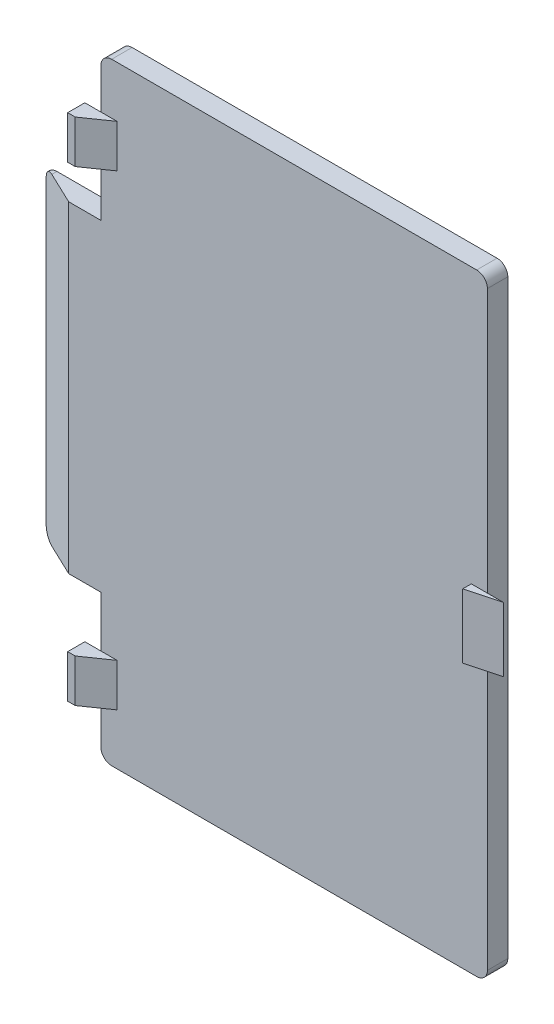
from build123d import *

# Parameters (mm, degrees)
RESSALTO_EXTRUS_O2_DEPTH = 1.9
RESSALTO_EXTRUS_O3_DEPTH = 1.5
CORTE_EXTRUS_O1_DEPTH    = 100
ESBO_O5_W                = 0.8
ESBO_O5_H                = 6
RESSALTO_EXTRUS_O4_DEPTH = 1.5
CORTE_EXTRUS_O2_DEPTH    = 100
CORTE_EXTRUS_O3_DEPTH    = 1000


with BuildPart() as part:
    # Esboço1 → Ressalto-extrusão2 (new body)
    with BuildSketch(Plane.XY):
        with BuildLine():
            Line((-23.801253488, -0.31815777), (-23.801253488, -28.31815777))
            ThreePointArc((-23.801253488, -28.31815777), (-23.50836027, -29.025264551), (-22.801253488, -29.31815777))
            Line((-22.801253488, -29.31815777), (-16.801253488, -29.31815777))
            Line((-16.801253488, -29.31815777), (-16.801253488, -41.81815777))
            ThreePointArc((-16.801253488, -41.81815777), (-16.50836027, -42.525264551), (-15.801253488, -42.81815777))
            Line((-15.801253488, -42.81815777), (18.198746512, -42.81815777))
            ThreePointArc((18.198746512, -42.81815777), (18.905853293, -42.525264551), (19.198746512, -41.81815777))
            Line((19.198746512, -41.81815777), (19.198746512, 13.18184223))
            ThreePointArc((19.198746512, 13.18184223), (18.905853293, 13.888949011), (18.198746512, 14.18184223))
            Line((18.198746512, 14.18184223), (-15.801253488, 14.18184223))
            ThreePointArc((-15.801253488, 14.18184223), (-16.50836027, 13.888949011), (-16.801253488, 13.18184223))
            Line((-16.801253488, 13.18184223), (-16.801253488, 0.68184223))
            Line((-16.801253488, 0.68184223), (-22.801253488, 0.68184223))
            ThreePointArc((-22.801253488, 0.68184223), (-23.50836027, 0.388949011), (-23.801253488, -0.31815777))
        make_face()
    extrude(amount=RESSALTO_EXTRUS_O2_DEPTH)

    # Esboço3 → Ressalto-extrusão3 (add, symmetric)
    with BuildSketch(Plane.ZY.offset(16.801253488)):
        Polygon((1.9, -35.56815777), (1.9, -34.05815777), (3.5, -34.05815777), (3.5, -38.05815777), (1.9, -38.05815777), align=None)
        Polygon((1.9, 6.93184223), (1.9, 9.42184223), (3.5, 9.42184223), (3.5, 5.42184223), (1.9, 5.42184223), align=None)
    extrude(amount=RESSALTO_EXTRUS_O3_DEPTH, both=True)

    # Esboço4 → Corte-extrusão1 (cut)
    with BuildSketch(Plane(origin=(0, 0.68184223, 0), x_dir=(1, 0, 0), z_dir=(0, 1, 0))):
        Polygon((-23.801253488, 0), (-19.801253488, -1.9), (-23.801253488, -1.9), align=None)
    extrude(amount=-CORTE_EXTRUS_O1_DEPTH, mode=Mode.SUBTRACT)

    # Esboço5 → Ressalto-extrusão4 (add, symmetric)
    with BuildSketch(Plane(origin=(19.198746512, 0, 0), x_dir=(0, 0, -1), z_dir=(1, 0, 0))):
        with Locations((-2.3, -14.390539287)):
            Rectangle(ESBO_O5_W, ESBO_O5_H)
    extrude(amount=RESSALTO_EXTRUS_O4_DEPTH, both=True)

    # Esboço6 → Corte-extrusão2 (cut)
    with BuildSketch(Plane(origin=(0, -17.390539287, 0), x_dir=(-1, 0, 0), z_dir=(0, -1, 0))):
        Polygon((-20.698746512, -1.9), (-17.698746512, -2.7), (-20.698746512, -2.7), align=None)
    extrude(amount=-CORTE_EXTRUS_O2_DEPTH, mode=Mode.SUBTRACT)

    # Esboço7 → Corte-extrusão3 (cut)
    with BuildSketch(Plane(origin=(0, 9.42184223, 0), x_dir=(1, 0, 0), z_dir=(0, 1, 0))):
        Polygon((-15.301253488, -1.9), (-17.601253488, -3.5), (-15.301253488, -3.5), align=None)
    extrude(amount=-CORTE_EXTRUS_O3_DEPTH, mode=Mode.SUBTRACT)


solid = part.part
